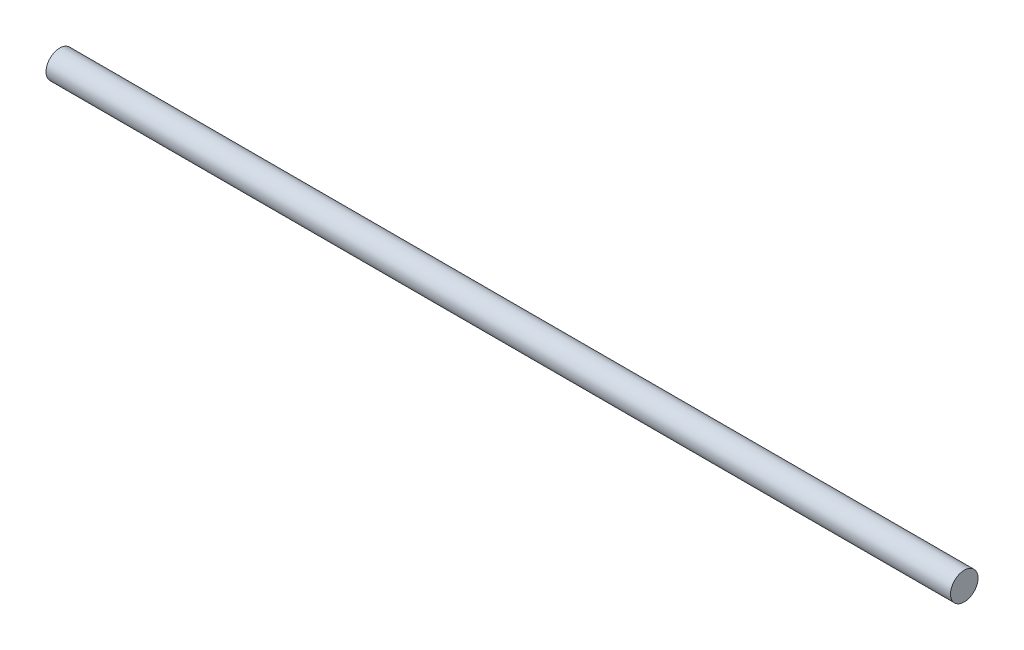
from build123d import *

# Parameters (mm, degrees)
ESQUISSE1_W = 460
ESQUISSE1_H = 7


with BuildPart() as part:
    # Esquisse1 → Révolution1 (revolve)
    with BuildSketch(Plane(origin=(0, 0, 0), x_dir=(1, 0, 0), z_dir=(0, 1, 0)), mode=Mode.PRIVATE) as r_volution1_sk:
        with Locations((230, 3.5)):
            Rectangle(ESQUISSE1_W, ESQUISSE1_H)
    revolve(r_volution1_sk.sketch.rotate(Axis((0, 0, 0), (1, 0, 0)), 180), axis=Axis((0, 0, 0), (1, 0, 0)))


solid = part.part
